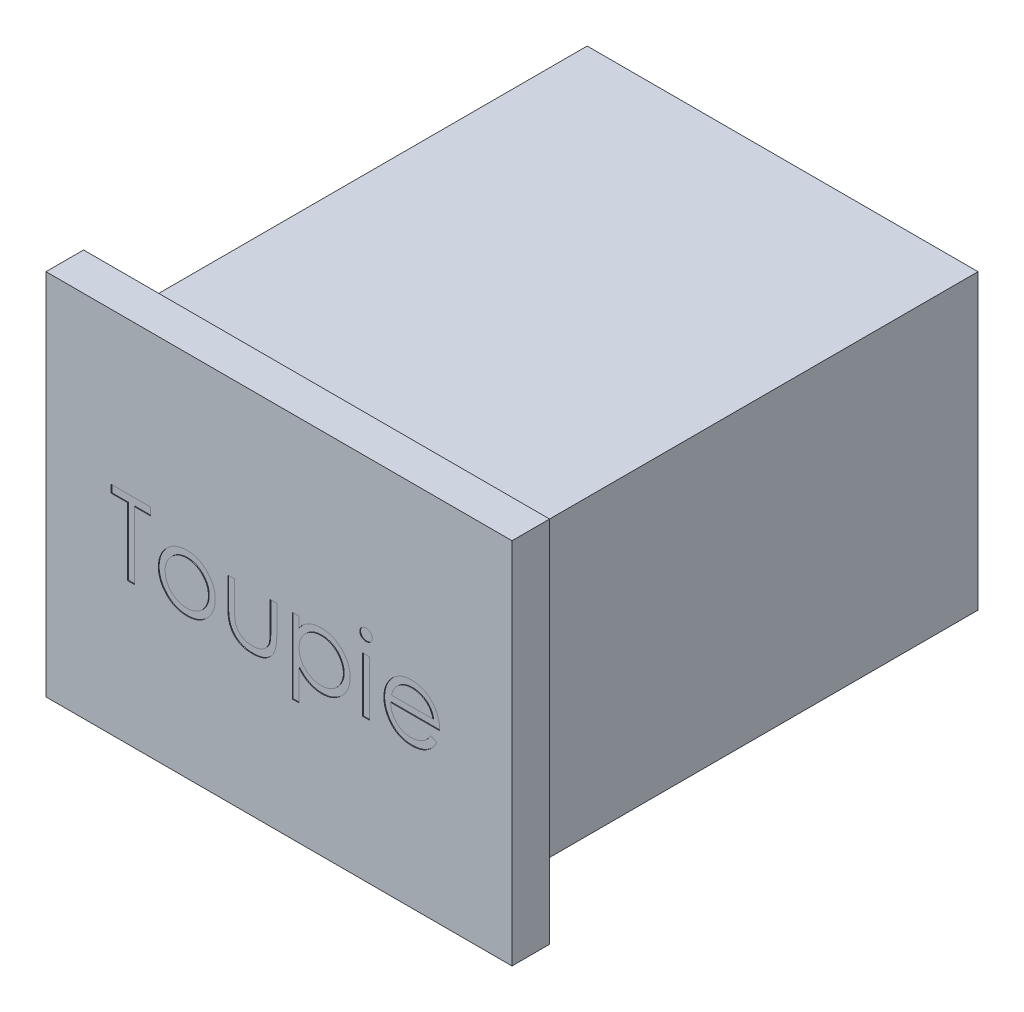
from build123d import *

# Parameters (mm, degrees)
ESQUISSE1_W             = 620
ESQUISSE1_H             = 490
BOSS_EXTRU_1_DEPTH      = 50
ESQUISSE2_W             = 520
ESQUISSE2_H             = 390
BOSS_EXTRU_2_DEPTH      = 620
ESQUISSE3_W             = 8.974358975
ESQUISSE3_H             = 73.076923077
ENL_V_MAT_EXTRU_1_DEPTH = 1


with BuildPart() as part:
    # Esquisse1 → Boss.-Extru.1 (new body)
    with BuildSketch(Plane.XY):
        with Locations((310, 245)):
            Rectangle(ESQUISSE1_W, ESQUISSE1_H)
    extrude(amount=BOSS_EXTRU_1_DEPTH)

    # Esquisse2 → Boss.-Extru.2 (add)
    with BuildSketch(Plane(origin=(0, 0, 0), x_dir=(-1, 0, 0), z_dir=(0, 0, -1))):
        with Locations((-310, 245)):
            Rectangle(ESQUISSE2_W, ESQUISSE2_H)
    extrude(amount=BOSS_EXTRU_2_DEPTH)

    # Esquisse3 → Enlèv. mat.-Extru.1 (cut)
    # profile 1 of 7: a face of its own
    with BuildSketch(Plane.XY.offset(50)):
        Polygon((86.709216884, 278.109332672), (86.709216884, 288.365742929), (139.273319448, 288.365742929), (139.273319448, 278.109332672), (117.478447653, 278.109332672), (117.478447653, 188.365742929), (108.504088679, 188.365742929), (108.504088679, 278.109332672), align=None)
    # profile 2 of 7: a face of its own
    with BuildSketch(Plane.XY.offset(50)):
        with BuildLine():
            add(Edge.make_bspline(
                [(187.390306628, 262.724717288), (188.761485852, 262.695520398), (191.450033211, 262.638272433), (195.387401379, 262.026416271), (199.145833834, 261.090777289), (202.739725039, 259.797304087), (206.123047766, 258.063534071), (209.345083312, 255.994697182), (212.396997852, 253.543765937), (214.226227259, 251.647821126), (215.154729705, 250.685454467)],
                knots=[0, 0, 0, 0, 1.054011418, 2.066658804, 3.057071809, 4.030435133, 4.997543892, 5.974964718, 6.972108034, 8, 8, 8, 8], degree=3))
            add(Edge.make_bspline(
                [(215.154729705, 250.685454467), (215.954214106, 249.765054873), (217.537710685, 247.942067953), (219.568159793, 244.986193297), (221.317347226, 241.925047566), (222.719146111, 238.717981089), (223.824432502, 235.392990485), (224.609166681, 231.938647309), (225.075936251, 228.362580247), (225.138878163, 225.933899159), (225.170755346, 224.703883954)],
                knots=[0, 0, 0, 0, 1.025258237, 2.030674902, 3.01204498, 3.988269485, 4.97094183, 5.956517959, 6.965070386, 8, 8, 8, 8], degree=3))
            add(Edge.make_bspline(
                [(225.170755346, 224.703883954), (225.142717137, 223.466739449), (225.087312328, 221.022084212), (224.563209002, 217.421530903), (223.74803512, 213.930250255), (222.581411172, 210.562859005), (221.085465193, 207.309063936), (219.260016978, 204.183076814), (217.092256488, 201.178730149), (214.634999438, 198.32153477), (211.919231548, 195.688214347), (208.973055881, 193.393120932), (205.854369203, 191.426791664), (202.521701966, 189.842894075), (199.005488057, 188.594045495), (195.298143254, 187.716902168), (191.405426959, 187.186568346), (188.747506349, 187.118466253), (187.390306628, 187.083691647)],
                knots=[0, 0, 0, 0, 0.998656419, 1.973391657, 2.932242238, 3.890759089, 4.846373663, 5.82037756, 6.809684879, 7.83454468, 8.860553229, 9.859544525, 10.845671541, 11.83227036, 12.833544569, 13.85385346, 14.904124723, 16, 16, 16, 16], degree=3))
            add(Edge.make_bspline(
                [(187.390306628, 187.083691647), (186.026457499, 187.118582967), (183.355290078, 187.186919381), (179.448833452, 187.714841745), (175.734844339, 188.593641247), (172.214027239, 189.846998182), (168.867031612, 191.426842289), (165.730274556, 193.387176277), (162.781705541, 195.688894998), (160.065363129, 198.321350342), (157.60826012, 201.178777666), (155.440459881, 204.18306448), (153.615021991, 207.30906715), (152.119073309, 210.562858148), (150.952450083, 213.930250485), (150.137276006, 217.421530841), (149.613172733, 221.022084228), (149.557767917, 223.466739455), (149.529729705, 224.703883954)],
                knots=[0, 0, 0, 0, 1.099876186, 2.154163076, 3.173186993, 4.173200201, 5.163417411, 6.152872554, 7.150605724, 8.17532212, 9.198891216, 10.186952605, 11.159729845, 12.11414092, 13.071450619, 14.029093627, 15.002601286, 16, 16, 16, 16], degree=3))
            add(Edge.make_bspline(
                [(149.529729705, 224.703883954), (149.561824286, 225.927213837), (149.625366042, 228.349196763), (150.091666301, 231.918541353), (150.873339343, 235.367038184), (151.979950671, 238.67919464), (153.39467041, 241.872207098), (155.119278637, 244.940916555), (157.170439567, 247.88342514), (158.747638182, 249.704055998), (159.545755346, 250.625358313)],
                knots=[0, 0, 0, 0, 1.031353054, 2.041901799, 3.029428768, 4.008703097, 4.981709435, 5.96992636, 6.972712378, 8, 8, 8, 8], degree=3))
            add(Edge.make_bspline(
                [(159.545755346, 250.625358313), (160.472857946, 251.596070864), (162.296168342, 253.505147898), (165.363274849, 255.948934301), (168.577384023, 258.060822125), (171.998096199, 259.760142567), (175.589034997, 261.09838593), (179.366727641, 262.028829219), (183.317456654, 262.636067933), (186.019160114, 262.694873013), (187.390306628, 262.724717288)],
                knots=[0, 0, 0, 0, 1.027980169, 2.021703884, 2.998553061, 3.971491411, 4.943284454, 5.930300938, 6.949603206, 8, 8, 8, 8], degree=3))
        make_face()
        with BuildLine():
            add(Edge.make_bspline(
                [(187.350242525, 253.750358313), (186.380596487, 253.722798551), (184.466335668, 253.668390478), (181.648633248, 253.254564629), (178.936057421, 252.598921656), (176.323461875, 251.667377191), (173.819656949, 250.464551508), (171.422245451, 248.987169788), (169.12417574, 247.254799603), (166.970402501, 245.270151842), (164.99376501, 243.10218057), (163.265822822, 240.792227459), (161.796534069, 238.377760422), (160.572529527, 235.856268676), (159.660895582, 233.202199707), (158.998809225, 230.445610243), (158.585373783, 227.580884058), (158.531477252, 225.633426392), (158.504088679, 224.643787801)],
                knots=[0, 0, 0, 0, 1.021534396, 2.016698045, 2.994645724, 3.958388632, 4.93408049, 5.916473867, 6.921342795, 7.962252576, 8.998418191, 10.008913653, 10.997312074, 11.973003931, 12.956656626, 13.948281152, 14.957379055, 16, 16, 16, 16], degree=3))
            add(Edge.make_bspline(
                [(158.504088679, 224.643787801), (158.549997926, 223.365158453), (158.641119196, 220.827318296), (159.382125951, 217.089857649), (160.621733948, 213.501804731), (162.295656225, 210.084193701), (164.392976759, 206.922128614), (166.864035807, 204.102943347), (169.68231296, 201.66906302), (172.814212965, 199.64961029), (176.195764906, 198.045045841), (179.774516937, 196.90793225), (183.507108196, 196.168741038), (186.057986229, 196.095270342), (187.350242525, 196.058050621)],
                knots=[0, 0, 0, 0, 1.016792936, 2.018143844, 3.017858371, 4.030088057, 5.03801393, 6.028138512, 7.003788237, 7.991172063, 8.984598303, 9.972568034, 10.972917682, 12, 12, 12, 12], degree=3))
            add(Edge.make_bspline(
                [(187.350242525, 196.058050621), (188.642424495, 196.0954872), (191.193155808, 196.169385967), (194.920560861, 196.904209388), (198.489531485, 198.050028265), (201.867571129, 199.64780569), (204.998045513, 201.676731827), (207.836591836, 204.089199743), (210.286552154, 206.929595496), (212.381798009, 210.088382034), (214.083133515, 213.496506379), (215.31693928, 217.090519874), (216.059727448, 220.827149643), (216.150608269, 223.36510195), (216.196396371, 224.643787801)],
                knots=[0, 0, 0, 0, 1.02726834, 2.027799167, 3.010890988, 4.004497153, 4.992059811, 5.971914811, 6.958719428, 7.966827853, 8.981595046, 9.981490638, 10.983022906, 12, 12, 12, 12], degree=3))
            add(Edge.make_bspline(
                [(216.196396371, 224.643787801), (216.169017228, 225.633432307), (216.115139253, 227.580901611), (215.701568842, 230.445543142), (215.039981994, 233.202445903), (214.126507216, 235.855360283), (212.907821106, 238.384288978), (211.410198446, 240.785138322), (209.689312006, 243.110182495), (207.688822838, 245.26314366), (205.537297755, 247.255573277), (203.238296665, 248.987841545), (200.844440134, 250.45805856), (198.3479092, 251.677665433), (195.734978696, 252.590446585), (193.026203577, 253.258350342), (190.220523293, 253.666641675), (188.31312206, 253.722274288), (187.350242525, 253.750358313)],
                knots=[0, 0, 0, 0, 1.042956736, 2.052379634, 3.044323526, 4.02829302, 5.004299113, 5.996692471, 7.007513377, 8.048758398, 9.090003419, 10.095195979, 11.07790575, 12.047570684, 13.018257071, 13.989683339, 14.985167495, 16, 16, 16, 16], degree=3))
        make_face(mode=Mode.SUBTRACT)
    # profile 3 of 7: a face of its own
    with BuildSketch(Plane.XY.offset(50)):
        with BuildLine():
            Line((241.837422012, 261.442666006), (250.811780987, 261.442666006))
            Line((250.811780987, 261.442666006), (250.811780987, 227.548435236))
            add(Edge.make_bspline(
                [(250.811780987, 227.548435236), (250.815835412, 226.553499546), (250.823591339, 224.650234173), (250.876189651, 221.911514551), (250.999906612, 219.41389419), (251.154587313, 217.155930283), (251.353505487, 215.138004809), (251.59017293, 213.367166036), (251.854699262, 211.823332206), (252.113633947, 210.893522043), (252.234056628, 210.461095493)],
                knots=[0, 0, 0, 0, 1.388932606, 2.656963016, 3.823490214, 4.879454478, 5.816252168, 6.653371382, 7.373723809, 8, 8, 8, 8], degree=3))
            add(Edge.make_bspline(
                [(252.234056628, 210.461095493), (252.427241057, 209.917584894), (252.809593657, 208.841863148), (253.503121764, 207.287891571), (254.361074238, 205.848597788), (255.299926463, 204.468481424), (256.38276668, 203.188424656), (257.595894427, 202.010589123), (258.898701198, 200.890472231), (260.834559009, 199.56519246), (263.481966609, 198.144754456), (266.957759618, 196.919159645), (270.726451786, 196.186707644), (273.331158052, 196.10172893), (274.669954064, 196.058050621)],
                knots=[0, 0, 0, 0, 0.725840625, 1.436591201, 2.137033971, 2.831655856, 3.53531722, 4.242432219, 4.957935707, 5.694543706, 7.190802206, 8.724350549, 10.316345118, 12, 12, 12, 12], degree=3))
            add(Edge.make_bspline(
                [(274.669954064, 196.058050621), (276.008625713, 196.102657724), (278.598707664, 196.188964214), (282.325992501, 196.897065318), (285.73317577, 198.080085004), (288.786060093, 199.73172534), (291.470798383, 201.752927135), (293.708067491, 204.124607384), (295.553989049, 206.771732724), (296.359972496, 208.746712119), (296.765306628, 209.739941647)],
                knots=[0, 0, 0, 0, 1.157059328, 2.238695713, 3.266970494, 4.264342957, 5.228770407, 6.160125903, 7.074715775, 8, 8, 8, 8], degree=3))
            add(Edge.make_bspline(
                [(296.765306628, 209.739941647), (296.885141772, 210.138978751), (297.150068011, 211.021152334), (297.434706625, 212.517716574), (297.691119814, 214.302419561), (297.910067704, 216.386939809), (298.066215207, 218.765829879), (298.150387395, 221.438346341), (298.245480973, 224.396099488), (298.246924295, 226.466606897), (298.247678423, 227.548435236)],
                knots=[0, 0, 0, 0, 0.557542046, 1.232589297, 2.036731608, 2.971723315, 4.038036528, 5.22795436, 6.551621927, 8, 8, 8, 8], degree=3))
            Line((298.247678423, 227.548435236), (298.247678423, 261.442666006))
            Line((298.247678423, 261.442666006), (307.222037397, 261.442666006))
            Line((307.222037397, 261.442666006), (307.222037397, 225.865742929))
            add(Edge.make_bspline(
                [(307.222037397, 225.865742929), (307.209417545, 224.656966602), (307.184933306, 222.311775177), (307.027580635, 218.903657705), (306.757591702, 215.727593566), (306.347800703, 212.781901569), (305.865924285, 210.068830663), (305.244316486, 207.584903635), (304.502081122, 205.337773522), (303.664780694, 203.288008467), (302.675584479, 201.429525776), (301.623383893, 199.665645301), (300.408390412, 198.040132868), (299.129240861, 196.472071805), (297.706336408, 195.039456737), (296.166340437, 193.709414569), (294.530928442, 192.461613661), (292.763808499, 191.344719965), (290.89077813, 190.338530098), (288.909525072, 189.446642152), (286.795782267, 188.740854235), (284.57682121, 188.131978072), (282.241770372, 187.65442181), (279.792880856, 187.31766276), (277.230977534, 187.111224734), (275.484992972, 187.093023452), (274.589825858, 187.083691647)],
                knots=[0, 0, 0, 0, 1.493040784, 2.896703357, 4.213163133, 5.428574705, 6.569057535, 7.615249723, 8.588095153, 9.490268104, 10.346124644, 11.18633936, 12.024365274, 12.850166724, 13.684164916, 14.514361689, 15.362232829, 16.222528818, 17.093394965, 17.986930858, 18.902426812, 19.842810585, 20.827885679, 21.843828298, 22.894529745, 24, 24, 24, 24], degree=3))
            add(Edge.make_bspline(
                [(274.589825858, 187.083691647), (273.701354027, 187.093397565), (271.955424168, 187.112470598), (269.393388617, 187.316522247), (266.937714152, 187.653898551), (264.597131337, 188.135476191), (262.369291414, 188.736592475), (260.245170275, 189.450979202), (258.249639903, 190.338992967), (256.358725503, 191.338351752), (254.587228697, 192.468788192), (252.926983609, 193.707875039), (251.380216394, 195.053762555), (249.946585879, 196.500829902), (248.646215119, 198.067028084), (247.462899643, 199.739758377), (246.378422352, 201.502446623), (245.396914057, 203.38996555), (244.553721041, 205.463451544), (243.809285444, 207.757654318), (243.200410062, 210.297726227), (242.704910966, 213.081495611), (242.306298377, 216.095639657), (242.029551456, 219.35759438), (241.874813435, 222.859414155), (241.850154537, 225.277982442), (241.837422012, 226.526800621)],
                knots=[0, 0, 0, 0, 1.083640291, 2.129454052, 3.13281866, 4.105697902, 5.042300162, 5.946461698, 6.836384745, 7.703652036, 8.553297018, 9.397182691, 10.228592656, 11.052265423, 11.879314572, 12.708807002, 13.549817954, 14.402308542, 15.300838682, 16.27712199, 17.341985831, 18.484375296, 19.725102775, 21.0496083, 22.476576903, 24, 24, 24, 24], degree=3))
            Line((241.837422012, 226.526800621), (241.837422012, 261.442666006))
        make_face()
    # profile 4 of 7: a face of its own
    with BuildSketch(Plane.XY.offset(50)):
        with BuildLine():
            Line((327.73485791, 261.442666006), (336.709216884, 261.442666006))
            Line((336.709216884, 261.442666006), (336.709216884, 247.92103139))
            add(Edge.make_bspline(
                [(336.709216884, 247.92103139), (337.662287857, 249.147823785), (339.514390563, 251.531849297), (342.706530702, 254.617281542), (346.075868099, 257.219433075), (349.709108457, 259.258934017), (353.549785314, 260.796671501), (357.582137241, 261.933227212), (361.840387666, 262.602983629), (364.751714886, 262.68360252), (366.236460474, 262.724717288)],
                knots=[0, 0, 0, 0, 1.0828784, 2.104357462, 3.088488658, 4.04616522, 5.001424249, 5.969181776, 6.964304535, 8, 8, 8, 8], degree=3))
            add(Edge.make_bspline(
                [(366.236460474, 262.724717288), (367.533363422, 262.687197891), (370.096760231, 262.613038832), (373.869995343, 262.110951559), (377.50357773, 261.25044606), (380.9769507, 260.010419907), (384.327323991, 258.47740648), (387.505098272, 256.542634035), (390.55977129, 254.302457156), (393.41451955, 251.724395704), (396.052272908, 248.935016663), (398.333592369, 245.934379402), (400.301361063, 242.821162648), (401.891940962, 239.54710287), (403.137893746, 236.137982018), (404.024027392, 232.580026563), (404.551388635, 228.886428265), (404.622144397, 226.374921963), (404.657934833, 225.10452498)],
                knots=[0, 0, 0, 0, 1.041296284, 2.058176809, 3.050446431, 4.034000596, 5.01514041, 6.003636468, 7.015969324, 8.052561599, 9.08815499, 10.094063707, 11.074456064, 12.040834395, 13.011057502, 13.983766392, 14.980127149, 16, 16, 16, 16], degree=3))
            add(Edge.make_bspline(
                [(404.657934833, 225.10452498), (404.62292096, 223.807316164), (404.553868549, 221.249033179), (404.018296951, 217.492258972), (403.162386261, 213.878334006), (401.932152458, 210.413269332), (400.342395648, 207.099450724), (398.407979637, 203.93926798), (396.125509148, 200.933733604), (393.516905499, 198.123650744), (390.686821612, 195.535098947), (387.661750484, 193.271154101), (384.488638325, 191.369971949), (381.183719264, 189.78188739), (377.718701021, 188.584967846), (374.10975023, 187.721602113), (370.358831758, 187.18918795), (367.807370273, 187.119126737), (366.516909192, 187.083691647)],
                knots=[0, 0, 0, 0, 1.038740735, 2.04854663, 3.033179607, 4.009277356, 4.987731542, 5.972001279, 6.972200261, 8.005528982, 9.039189865, 10.040446548, 11.026516639, 11.997840187, 12.972163198, 13.956796175, 14.96660207, 16, 16, 16, 16], degree=3))
            add(Edge.make_bspline(
                [(366.516909192, 187.083691647), (365.06469285, 187.120686153), (362.19613982, 187.193761148), (358.001920666, 187.934315721), (353.965439182, 189.041085312), (350.131415619, 190.661056558), (346.469478118, 192.725499869), (343.00034081, 195.242934325), (339.705576442, 198.208095032), (337.722469091, 200.457575494), (336.709216884, 201.606928826)],
                knots=[0, 0, 0, 0, 1.014726462, 2.004382257, 2.969841629, 3.936926163, 4.907207904, 5.903978561, 6.929055279, 8, 8, 8, 8], degree=3))
            Line((336.709216884, 201.606928826), (336.709216884, 161.442666006))
            Line((336.709216884, 161.442666006), (327.73485791, 161.442666006))
            Line((327.73485791, 161.442666006), (327.73485791, 261.442666006))
        make_face()
        with BuildLine():
            add(Edge.make_bspline(
                [(366.156332269, 253.750358313), (365.13977334, 253.732065222), (363.138430833, 253.696050839), (360.204938862, 253.268223731), (357.379355212, 252.647145411), (354.6901566, 251.706805404), (352.111567558, 250.552553599), (349.663448565, 249.110210422), (347.347518063, 247.405867398), (345.169602909, 245.472171858), (343.202080238, 243.341466483), (341.460282296, 241.067529079), (339.997216437, 238.653239376), (338.782873001, 236.121086161), (337.85877921, 233.451220871), (337.202901502, 230.65884908), (336.790605707, 227.740914439), (336.736636071, 225.753599968), (336.709216884, 224.743948057)],
                knots=[0, 0, 0, 0, 1.05670511, 2.080379991, 3.077984906, 4.06214886, 5.038337365, 6.01289324, 7.01187578, 8.025460281, 9.038092164, 10.024533457, 11.000252242, 11.969694649, 12.940728589, 13.933144304, 14.949937299, 16, 16, 16, 16], degree=3))
            add(Edge.make_bspline(
                [(336.709216884, 224.743948057), (336.754669916, 223.418573413), (336.843716254, 220.822052236), (337.567641053, 217.028220181), (338.745791454, 213.438172881), (340.418040416, 210.082143253), (342.530828252, 206.996919392), (345.076489864, 204.234330635), (348.031991322, 201.81174232), (351.348196799, 199.771135071), (354.903114817, 198.114333175), (358.611283733, 196.928212877), (362.421708901, 196.197577781), (364.997946608, 196.104811521), (366.296556628, 196.058050621)],
                knots=[0, 0, 0, 0, 1.03728447, 2.032128127, 3.01272805, 3.987917167, 4.958271349, 5.931593992, 6.91984656, 7.941419022, 8.973179163, 9.983609215, 10.983593296, 12, 12, 12, 12], degree=3))
            add(Edge.make_bspline(
                [(366.296556628, 196.058050621), (367.569007141, 196.102518532), (370.094592654, 196.190779341), (373.813396125, 196.954727558), (377.427414365, 198.121728259), (380.861133579, 199.823429872), (384.084661801, 201.908860101), (386.995563331, 204.410575334), (389.538618004, 207.310287998), (391.706171006, 210.539102366), (393.452784871, 214.001256184), (394.765077441, 217.583581572), (395.522465248, 221.273450804), (395.629802063, 223.759099744), (395.683575858, 225.004364724)],
                knots=[0, 0, 0, 0, 1.00104056, 1.986885549, 2.97790532, 3.984399681, 4.995088187, 5.994304198, 6.996462723, 8.023150851, 9.048424203, 10.043036403, 11.019596776, 12, 12, 12, 12], degree=3))
            add(Edge.make_bspline(
                [(395.683575858, 225.004364724), (395.642012035, 226.257364413), (395.559208211, 228.753601661), (394.743578562, 232.432541746), (393.517864914, 236.029341063), (391.730463429, 239.444213913), (389.610427159, 242.666330559), (387.046227246, 245.510727102), (384.171478776, 248.001317752), (380.951788377, 250.05890089), (377.49634765, 251.695629318), (373.858778624, 252.892304715), (370.057532841, 253.6115547), (367.468171283, 253.703683452), (366.156332269, 253.750358313)],
                knots=[0, 0, 0, 0, 0.983928682, 1.960191568, 2.949917689, 3.96440592, 4.982380491, 5.975291189, 6.965713506, 7.964880129, 8.970154049, 9.96478489, 10.968906225, 12, 12, 12, 12], degree=3))
        make_face(mode=Mode.SUBTRACT)
    # profile 5 of 7: a face of its own
    with BuildSketch(Plane.XY.offset(50)):
        with BuildLine():
            add(Edge.make_bspline(
                [(425.771716884, 292.211896775), (426.328611621, 292.186063849), (427.419118474, 292.13547802), (428.996068979, 291.70229296), (430.431983609, 290.968016233), (431.70563312, 289.982882493), (432.798544168, 288.824326966), (433.563707322, 287.474013586), (434.055490068, 286.015195335), (434.114877362, 284.997621358), (434.14511432, 284.47952498)],
                knots=[0, 0, 0, 0, 1.055194115, 2.066272739, 3.074728998, 4.095836921, 5.109056067, 6.073838105, 7.019297344, 8, 8, 8, 8], degree=3))
            add(Edge.make_bspline(
                [(434.14511432, 284.47952498), (434.114195468, 283.974877747), (434.053072556, 282.977249889), (433.564087178, 281.543722116), (432.792023239, 280.21217116), (431.706333936, 279.055865154), (430.431797907, 278.071276011), (428.996118311, 277.336854899), (427.419105497, 276.903708118), (426.328607234, 276.853117011), (425.771716884, 276.82728139)],
                knots=[0, 0, 0, 0, 0.96129708, 1.900370562, 2.859976407, 3.87933698, 4.906634145, 5.921202961, 6.938410037, 8, 8, 8, 8], degree=3))
            add(Edge.make_bspline(
                [(425.771716884, 276.82728139), (425.221194736, 276.85213054), (424.149675303, 276.900496162), (422.596336951, 277.345353811), (421.172665825, 278.071527329), (419.896532321, 279.049418331), (418.832812517, 280.219272538), (418.058574648, 281.542909505), (417.570718594, 282.97745678), (417.509443491, 283.974947246), (417.478447653, 284.47952498)],
                knots=[0, 0, 0, 0, 1.054934014, 2.053291228, 3.073705704, 4.106921865, 5.123545215, 6.088680038, 7.033164197, 8, 8, 8, 8], degree=3))
            add(Edge.make_bspline(
                [(417.478447653, 284.47952498), (417.508764414, 284.997549254), (417.568308444, 286.014981615), (418.058940334, 287.474839698), (418.826363413, 288.817168321), (419.897236657, 289.989325447), (421.172478379, 290.967766441), (422.596385383, 291.693794484), (424.149662509, 292.138689894), (425.221190394, 292.187050304), (425.771716884, 292.211896775)],
                knots=[0, 0, 0, 0, 0.98631895, 1.937192651, 2.907499808, 3.917963147, 4.944918757, 5.95915025, 6.951458133, 8, 8, 8, 8], degree=3))
        make_face()
    # profile 6 of 7: a face of its own
    with BuildSketch(Plane.XY.offset(50)):
        with Locations((425.811780987, 224.904204468)):
            Rectangle(ESQUISSE3_W, ESQUISSE3_H)
    # profile 7 of 7: a face of its own
    with BuildSketch(Plane.XY.offset(50)):
        with BuildLine():
            Line((512.069793807, 211.442666006), (520.042550217, 207.255967288))
            add(Edge.make_bspline(
                [(520.042550217, 207.255967288), (519.407218925, 206.129014966), (518.171115825, 203.936412028), (516.045380171, 200.924073157), (513.81703524, 198.214138419), (511.385493297, 195.87900544), (508.82350247, 193.843251583), (506.116855191, 192.062170877), (503.251460398, 190.544498867), (500.227182547, 189.265855213), (497.018623943, 188.28272681), (493.618009189, 187.588320498), (490.018823607, 187.159084251), (487.551789896, 187.109223086), (486.288543807, 187.083691647)],
                knots=[0, 0, 0, 0, 1.120438281, 2.179929193, 3.190490725, 4.156257408, 5.095198341, 6.022838206, 6.959905092, 7.901321166, 8.864066838, 9.862729781, 10.905609505, 12, 12, 12, 12], degree=3))
            add(Edge.make_bspline(
                [(486.288543807, 187.083691647), (484.884487306, 187.116468085), (482.14557983, 187.18040542), (478.158729913, 187.731618689), (474.405032244, 188.630828938), (470.884697863, 189.886987266), (467.606347789, 191.527767954), (464.563466223, 193.526610292), (461.740051198, 195.87324614), (459.225073793, 198.588001668), (456.960962858, 201.493200448), (454.963082288, 204.520511433), (453.292869972, 207.662317847), (451.934223966, 210.898618534), (450.83694211, 214.209015492), (450.072179145, 217.623628851), (449.631329203, 221.133216972), (449.563773616, 223.507426564), (449.529729705, 224.703883954)],
                knots=[0, 0, 0, 0, 1.145258523, 2.234067595, 3.276747158, 4.290159414, 5.277019952, 6.260822364, 7.254936242, 8.264827045, 9.274100331, 10.257902744, 11.220704747, 12.172965371, 13.118907548, 14.062713208, 15.023725156, 16, 16, 16, 16], degree=3))
            add(Edge.make_bspline(
                [(449.529729705, 224.703883954), (449.559990885, 225.826593395), (449.61996455, 228.051655243), (449.997987047, 231.344956515), (450.667938277, 234.545769445), (451.587261819, 237.656753672), (452.774440281, 240.672700358), (454.226789401, 243.595445033), (455.946571624, 246.4218776), (457.274362303, 248.204824278), (457.943191243, 249.102922416)],
                knots=[0, 0, 0, 0, 1.024358464, 2.0301432, 3.019427413, 4.004406732, 4.986367066, 5.972626655, 6.978780325, 8, 8, 8, 8], degree=3))
            add(Edge.make_bspline(
                [(457.943191243, 249.102922416), (458.849125037, 250.184890133), (460.63229494, 252.314551574), (463.648190807, 255.112789454), (466.913910702, 257.456897316), (470.388528591, 259.399958348), (474.11242785, 260.876348262), (478.035550451, 261.976564898), (482.2025672, 262.593079499), (485.051287796, 262.680160459), (486.508896371, 262.724717288)],
                knots=[0, 0, 0, 0, 1.030682036, 2.02871468, 2.997146059, 3.962720338, 4.930598197, 5.918074684, 6.934738563, 8, 8, 8, 8], degree=3))
            add(Edge.make_bspline(
                [(486.508896371, 262.724717288), (488.00739938, 262.686030177), (490.947120692, 262.610134883), (495.233752722, 261.906525357), (499.289773195, 260.790738084), (503.113559032, 259.214915498), (506.705497911, 257.181785447), (510.042242184, 254.663447119), (513.180856829, 251.737216056), (515.006816224, 249.486838643), (515.935979705, 248.341704467)],
                knots=[0, 0, 0, 0, 1.056321875, 2.072262726, 3.055038591, 4.01806755, 4.982017516, 5.957941055, 6.960871419, 8, 8, 8, 8], degree=3))
            add(Edge.make_bspline(
                [(515.935979705, 248.341704467), (516.568177942, 247.478744999), (517.828366316, 245.758570179), (519.406854889, 242.953679977), (520.777066174, 240.019091567), (521.872293632, 236.907368793), (522.759136523, 233.655380788), (523.400759915, 230.23987951), (523.777034732, 226.661882043), (523.850997513, 224.223980458), (523.888704064, 222.981127544)],
                knots=[0, 0, 0, 0, 0.94817472, 1.890038105, 2.849395472, 3.817997239, 4.812318967, 5.836947057, 6.897266129, 8, 8, 8, 8], degree=3))
            Line((523.888704064, 222.981127544), (458.504088679, 222.981127544))
            add(Edge.make_bspline(
                [(458.504088679, 222.981127544), (458.548077434, 222.018257137), (458.634579547, 220.124811316), (459.037869352, 217.354217513), (459.673548602, 214.714979166), (460.566950392, 212.226892252), (461.648860256, 209.857460038), (462.97416645, 207.624258981), (464.555296563, 205.53746098), (466.318887974, 203.578399906), (468.281947841, 201.83380673), (470.34716919, 200.272327409), (472.54412819, 198.963596073), (474.855502004, 197.901313509), (477.277553008, 197.069704479), (479.811044297, 196.502052459), (482.450990479, 196.121849406), (484.25058288, 196.079573257), (485.166748935, 196.058050621)],
                knots=[0, 0, 0, 0, 1.094153842, 2.151609401, 3.174256925, 4.172055639, 5.149267565, 6.128595816, 7.11444997, 8.118368179, 9.117203808, 10.09244225, 11.054858984, 12.015122123, 12.976791628, 13.957293641, 14.960065497, 16, 16, 16, 16], degree=3))
            add(Edge.make_bspline(
                [(485.166748935, 196.058050621), (486.06249601, 196.075423669), (487.839830036, 196.109895127), (490.486711675, 196.445092582), (493.090698172, 196.987100457), (495.641011979, 197.726814459), (498.085893291, 198.629010234), (500.350051864, 199.717663309), (502.43234374, 200.921941788), (504.378542785, 202.299361075), (506.266285452, 203.985309275), (508.138927921, 206.089187017), (510.146832303, 208.577402097), (511.40367781, 210.450135411), (512.069793807, 211.442666006)],
                knots=[0, 0, 0, 0, 0.99110716, 1.966546729, 2.947904876, 3.932708344, 4.903319531, 5.828989031, 6.710028674, 7.56322171, 8.463672341, 9.504779593, 10.677557249, 12, 12, 12, 12], degree=3))
        make_face()
        with BuildLine():
            add(Edge.make_bspline(
                [(514.914345089, 231.955486519), (514.585870102, 233.145854339), (513.953661488, 235.436929213), (512.632622504, 238.609526083), (511.144864198, 241.429180397), (509.384243302, 243.87431277), (507.38942257, 246.045841713), (505.085274494, 247.943515575), (502.501391823, 249.641157034), (499.651130661, 251.07408559), (496.632793944, 252.293795839), (493.472617031, 253.111656289), (490.248108806, 253.671928926), (488.067129196, 253.724103453), (486.969633551, 253.750358313)],
                knots=[0, 0, 0, 0, 1.154881502, 2.222775134, 3.210006277, 4.132804581, 5.035138423, 5.962687519, 6.919655026, 7.923214229, 8.944639381, 9.960483929, 10.97369054, 12, 12, 12, 12], degree=3))
            add(Edge.make_bspline(
                [(486.969633551, 253.750358313), (486.073935307, 253.732881984), (484.303328192, 253.698334954), (481.694726243, 253.370616973), (479.189591988, 252.828907119), (476.769440914, 252.087051216), (474.465987532, 251.098234002), (472.231851297, 249.938713242), (470.123839976, 248.523239419), (468.805517248, 247.444414995), (468.139505346, 246.899396775)],
                knots=[0, 0, 0, 0, 1.04873581, 2.073130211, 3.073294108, 4.04793562, 5.032784715, 6.005352987, 6.992311501, 8, 8, 8, 8], degree=3))
            add(Edge.make_bspline(
                [(468.139505346, 246.899396775), (467.662554432, 246.468130614), (466.697322026, 245.595353013), (465.40759284, 244.091661397), (464.172722192, 242.470188192), (463.048903542, 240.668898918), (462.018115358, 238.708305232), (461.053544581, 236.604944225), (460.185361379, 234.342854789), (459.696901092, 232.766499383), (459.445595089, 231.955486519)],
                knots=[0, 0, 0, 0, 0.879870761, 1.780643979, 2.707998968, 3.669668524, 4.684282772, 5.740141944, 6.837334558, 8, 8, 8, 8], degree=3))
            Line((459.445595089, 231.955486519), (514.914345089, 231.955486519))
        make_face(mode=Mode.SUBTRACT)
    extrude(amount=-ENL_V_MAT_EXTRU_1_DEPTH, mode=Mode.SUBTRACT)


solid = part.part
